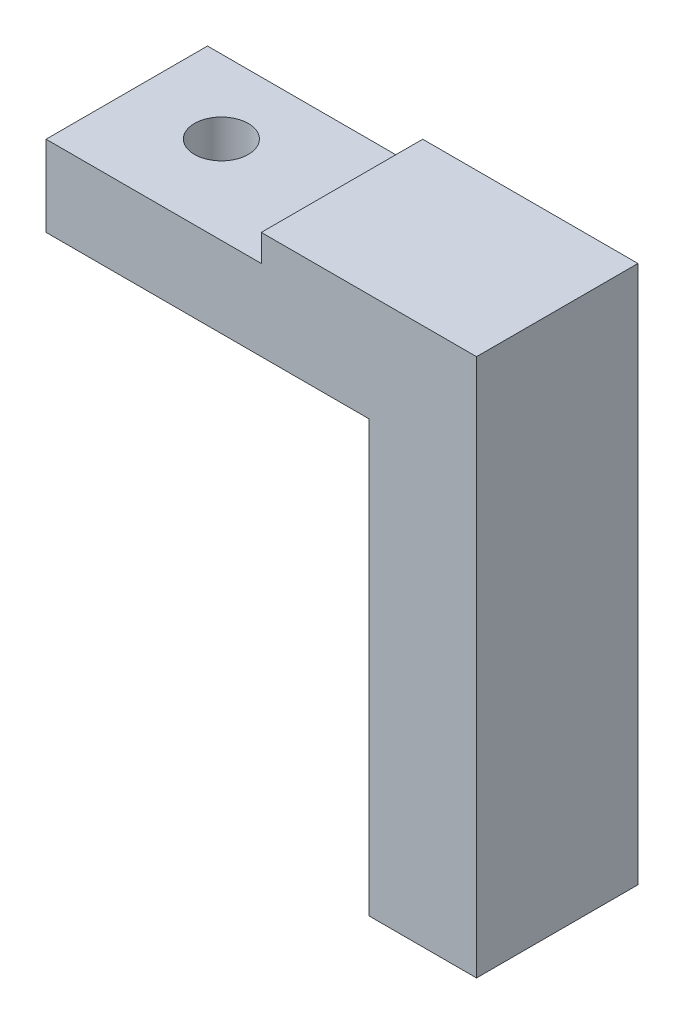
from build123d import *

# Parameters (mm, degrees)
SKETCH1_W           = 15
SKETCH1_H           = 6
BOSS_EXTRUDE1_DEPTH = 3
CUT_EXTRUDE1_REACH  = 18.432
SKETCH2_R           = 1
SKETCH3_W           = 3
SKETCH3_H           = 6
BOSS_EXTRUDE2_DEPTH = 16
SKETCH4_W           = 6
SKETCH4_H           = 19
BOSS_EXTRUDE3_DEPTH = 1
SKETCH5_W           = 8
SKETCH5_H           = 6
BOSS_EXTRUDE4_DEPTH = 1


with BuildPart() as part:
    # Sketch1 → Boss-Extrude1 (new body)
    with BuildSketch(Plane(origin=(0, 0, 0), x_dir=(1, 0, 0), z_dir=(0, 1, 0))):
        with Locations((7.5, -3)):
            Rectangle(SKETCH1_W, SKETCH1_H)
    extrude(amount=BOSS_EXTRUDE1_DEPTH)

    # Sketch2 → Cut-Extrude1 (cut, up to next)
    with BuildSketch(Plane(origin=(0, 3, 0), x_dir=(1, 0, 0), z_dir=(0, 1, 0)), mode=Mode.PRIVATE) as cut_extrude1_sk1:
        with Locations(Location((3.25, -2.733160164, 0), (0, 0, 270))):
            Circle(SKETCH2_R)
    cut_extrude1_tool1 = extrude(cut_extrude1_sk1.sketch, amount=-CUT_EXTRUDE1_REACH, mode=Mode.PRIVATE) & part.part
    add(cut_extrude1_tool1.solids().sort_by_distance((3.25, 3, 2.73316))[0], mode=Mode.SUBTRACT)

    # Sketch3 → Boss-Extrude2 (add)
    with BuildSketch(Plane.XZ):
        with Locations((13.5, 3)):
            Rectangle(SKETCH3_W, SKETCH3_H)
    extrude(amount=BOSS_EXTRUDE2_DEPTH)

    # Sketch4 → Boss-Extrude3 (add)
    with BuildSketch(Plane(origin=(15, 0, 0), x_dir=(0, 0, -1), z_dir=(1, 0, 0))):
        with Locations((-3, -6.5)):
            Rectangle(SKETCH4_W, SKETCH4_H)
    extrude(amount=BOSS_EXTRUDE3_DEPTH)

    # Sketch5 → Boss-Extrude4 (add)
    with BuildSketch(Plane(origin=(0, 3, 0), x_dir=(1, 0, 0), z_dir=(0, 1, 0))):
        with Locations((12, -3)):
            Rectangle(SKETCH5_W, SKETCH5_H)
    extrude(amount=BOSS_EXTRUDE4_DEPTH)


solid = part.part
